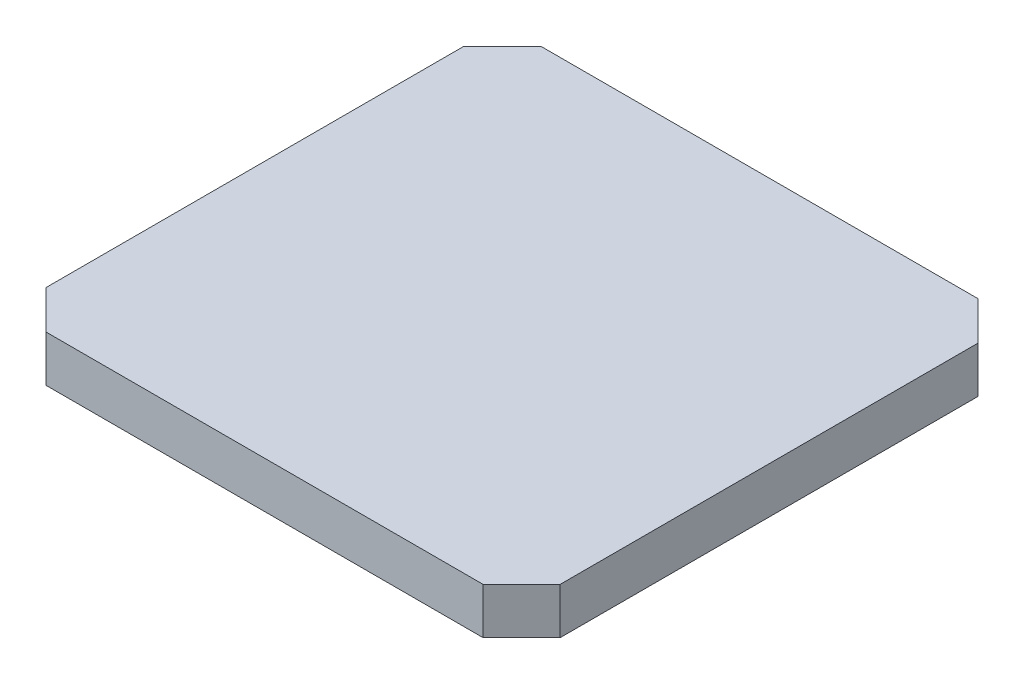
from build123d import *

# Parameters (mm, degrees)
BOSS_EXTRUDE1_DEPTH = 8.4


with BuildPart() as part:
    # Sketch4 → Boss-Extrude1 (new body)
    with BuildSketch(Plane(origin=(0, 0, 0), x_dir=(1, 0, 0), z_dir=(0, 1, 0))):
        Polygon((-46.75, 38), (-39.75, 45), (39.75, 45), (46.75, 38), (46.75, -38), (39.75, -45), (-39.75, -45), (-46.75, -38), align=None)
    extrude(amount=BOSS_EXTRUDE1_DEPTH)


solid = part.part
